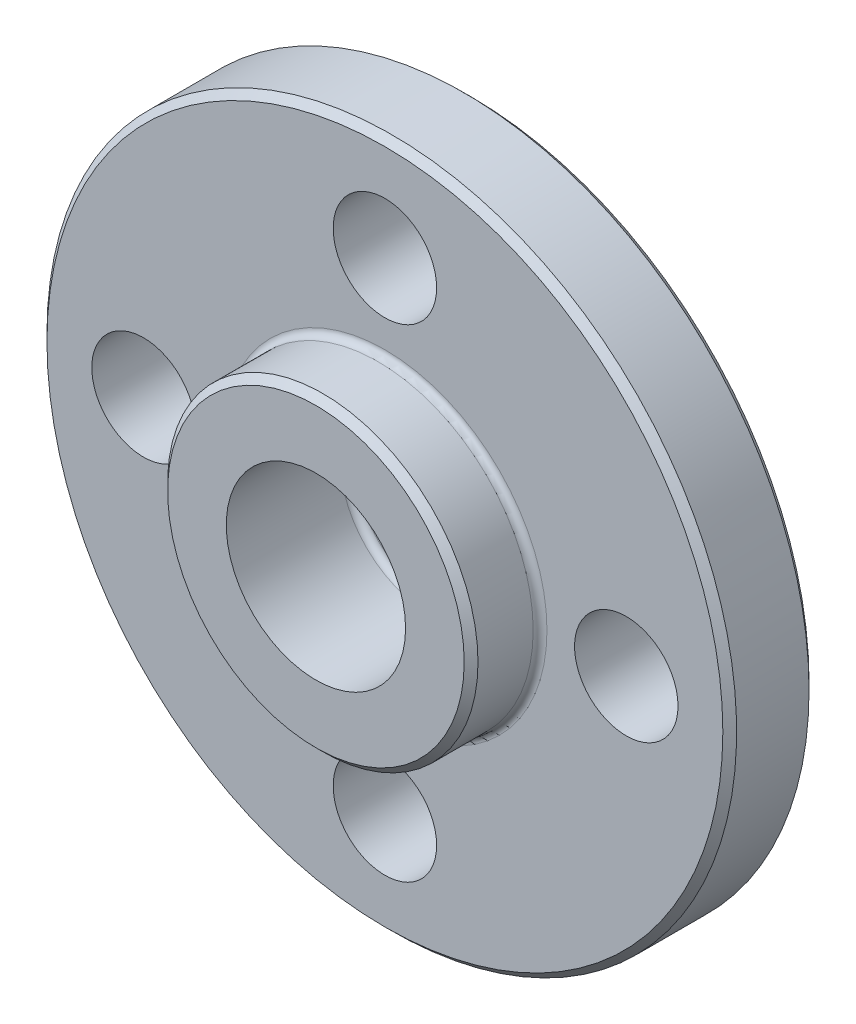
from build123d import *

# Parameters (mm, degrees)
SKETCH1_R           = 10
SKETCH1_R_2         = 1.5
BOSS_EXTRUDE1_DEPTH = 2.5
SKETCH2_R           = 4.5
BOSS_EXTRUDE2_DEPTH = 2
SKETCH3_R           = 2.6
CUT_EXTRUDE1_DEPTH  = 3.5
CHAMFER1_SIZE       = 0.2
FILLET1_R           = 0.2


with BuildPart() as part:
    # Sketch1 → Boss-Extrude1 (new body)
    with BuildSketch(Plane.XY):
        Circle(SKETCH1_R)
        with Locations((0, 7)):
            Circle(SKETCH1_R_2, mode=Mode.SUBTRACT)
        with Locations((7, 0)):
            Circle(SKETCH1_R_2, mode=Mode.SUBTRACT)
        with Locations((0, -7)):
            Circle(SKETCH1_R_2, mode=Mode.SUBTRACT)
        with Locations((-7, 0)):
            Circle(SKETCH1_R_2, mode=Mode.SUBTRACT)
        Circle(SKETCH1_R_2, mode=Mode.SUBTRACT)
    extrude(amount=BOSS_EXTRUDE1_DEPTH)

    # Sketch2 → Boss-Extrude2 (add)
    with BuildSketch(Plane.XY.offset(2.5)):
        Circle(SKETCH2_R)
    extrude(amount=BOSS_EXTRUDE2_DEPTH)

    # Sketch3 → Cut-Extrude1 (cut)
    with BuildSketch(Plane.XY.offset(4.5)):
        Circle(SKETCH3_R)
    extrude(amount=-CUT_EXTRUDE1_DEPTH, mode=Mode.SUBTRACT)

    # Chamfer1
    chamfer1_edges = [part.edges().sort_by_distance(p)[0] for p in [
        (-10, 0, 0),
        (-4.5, 0, 4.5),
        (-10, 0, 2.5),
    ]]
    chamfer(chamfer1_edges, length=CHAMFER1_SIZE)

    # Fillet1
    fillet1_edges = [part.edges().sort_by_distance(p)[0] for p in [
        (-4.5, 0, 2.5),
        (-2.6, 0, 1),
    ]]
    fillet(fillet1_edges, radius=FILLET1_R)


solid = part.part
